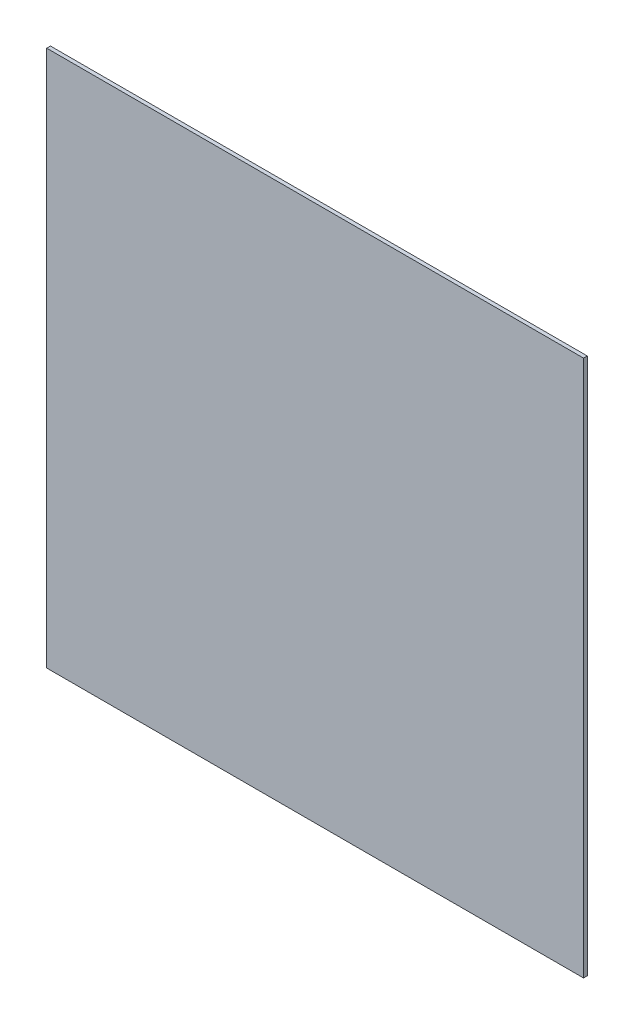
from build123d import *

# Parameters (mm, degrees)
SKETCH1_W           = 25.4
SKETCH1_H           = 25.4
BOSS_EXTRUDE1_DEPTH = 0.1778


with BuildPart() as part:
    # Sketch1 → Boss-Extrude1 (new body)
    with BuildSketch(Plane.XY):
        Rectangle(SKETCH1_W, SKETCH1_H)
    extrude(amount=BOSS_EXTRUDE1_DEPTH)


solid = part.part
